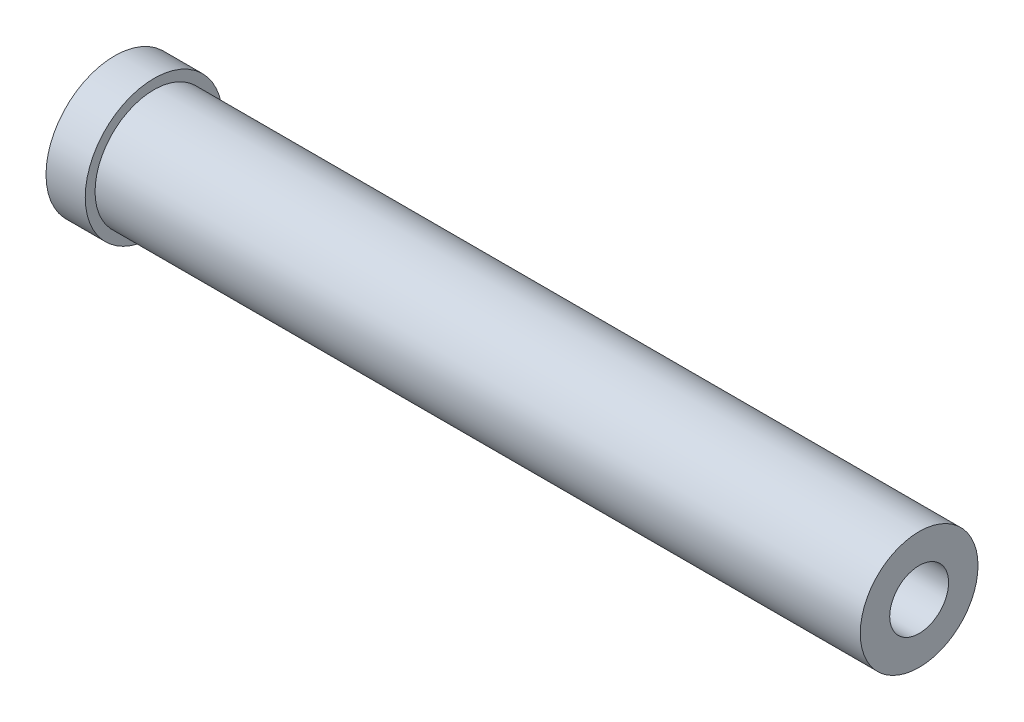
from build123d import *

# Parameters (mm, degrees)
SKETCH1_R           = 3.81
SKETCH1_R_2         = 1.905
BOSS_EXTRUDE1_DEPTH = 25.4
SKETCH2_R           = 4.445
BOSS_EXTRUDE2_DEPTH = 1.27


with BuildPart() as part:
    # Sketch1 → Boss-Extrude1 (new, symmetric)
    with BuildSketch(Plane(origin=(0, 0, 0), x_dir=(0, 0, -1), z_dir=(1, 0, 0))):
        Circle(SKETCH1_R)
        Circle(SKETCH1_R_2, mode=Mode.SUBTRACT)
    extrude(amount=BOSS_EXTRUDE1_DEPTH, both=True)

    # Sketch2 → Boss-Extrude2 (add, symmetric)
    with BuildSketch(Plane.ZY.offset(25.4)):
        Circle(SKETCH2_R)
    extrude(amount=BOSS_EXTRUDE2_DEPTH, both=True)


solid = part.part
